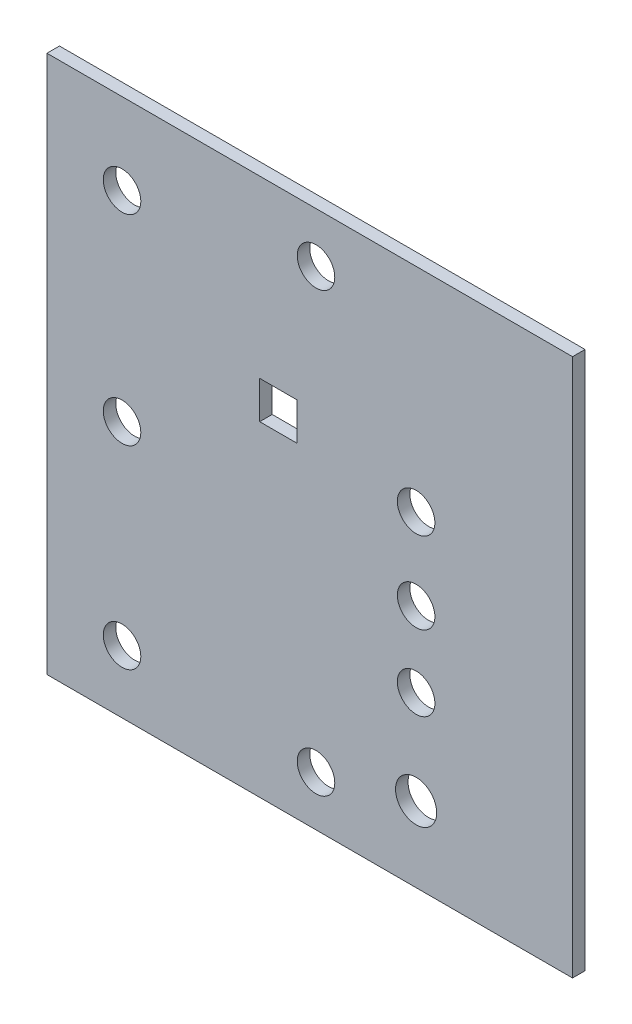
from build123d import *

# Parameters (mm, degrees)
SKETCH_1_W           = 86
SKETCH_1_H           = 86
EXTRUDE_1_DEPTH      = 2
SKETCH_2_R           = 3
CUT_EXTRUDE_1_DEPTH  = 3
SKETCH_3_R           = 3
CUT_EXTRUDE_2_DEPTH  = 3
SKETCH_4_R           = 3
CUT_EXTRUDE_3_DEPTH  = 3
SKETCH_6_R           = 3
CUT_EXTRUDE_4_DEPTH  = 3
SKETCH_7_R           = 3
CUT_EXTRUDE_5_DEPTH  = 3
SKETCH_8_R           = 3
CUT_EXTRUDE_6_DEPTH  = 3
SKETCH_9_R           = 3
CUT_EXTRUDE_7_DEPTH  = 3
SKETCH_10_R          = 3
CUT_EXTRUDE_8_DEPTH  = 3
SKETCH_11_R          = 3.290793372
CUT_EXTRUDE_9_DEPTH  = 3
SKETCH_12_W          = 6
SKETCH_12_H          = 6
CUT_EXTRUDE_10_DEPTH = 3
SKETCH_13_W          = 1
SKETCH_13_H          = 86
CUT_EXTRUDE_11_DEPTH = 3


with BuildPart() as part:
    # 草圖1 → 填料-伸長1 (new body)
    with BuildSketch(Plane.XY):
        with Locations((43, -43)):
            Rectangle(SKETCH_1_W, SKETCH_1_H)
    extrude(amount=EXTRUDE_1_DEPTH)

    # 草圖2 → 除料-伸長1 (cut)
    with BuildSketch(Plane.XY.offset(2)):
        with Locations((13, -13)):
            Circle(SKETCH_2_R)
    extrude(amount=-CUT_EXTRUDE_1_DEPTH, mode=Mode.SUBTRACT)

    # 草圖3 → 除料-伸長2 (cut)
    with BuildSketch(Plane.XY.offset(2)):
        with Locations((13, -45)):
            Circle(SKETCH_3_R)
    extrude(amount=-CUT_EXTRUDE_2_DEPTH, mode=Mode.SUBTRACT)

    # 草圖4 → 除料-伸長3 (cut)
    with BuildSketch(Plane.XY.offset(2)):
        with Locations((13, -76)):
            Circle(SKETCH_4_R)
    extrude(amount=-CUT_EXTRUDE_3_DEPTH, mode=Mode.SUBTRACT)

    # 草圖6 → 除料-伸長4 (cut)
    with BuildSketch(Plane.XY.offset(2)):
        with Locations((44, -8)):
            Circle(SKETCH_6_R)
    extrude(amount=-CUT_EXTRUDE_4_DEPTH, mode=Mode.SUBTRACT)

    # 草圖7 → 除料-伸長5 (cut)
    with BuildSketch(Plane.XY.offset(2)):
        with Locations((44, -78)):
            Circle(SKETCH_7_R)
    extrude(amount=-CUT_EXTRUDE_5_DEPTH, mode=Mode.SUBTRACT)

    # 草圖8 → 除料-伸長6 (cut)
    with BuildSketch(Plane.XY.offset(2)):
        with Locations((60, -34)):
            Circle(SKETCH_8_R)
    extrude(amount=-CUT_EXTRUDE_6_DEPTH, mode=Mode.SUBTRACT)

    # 草圖9 → 除料-伸長7 (cut)
    with BuildSketch(Plane.XY.offset(2)):
        with Locations((60, -47)):
            Circle(SKETCH_9_R)
    extrude(amount=-CUT_EXTRUDE_7_DEPTH, mode=Mode.SUBTRACT)

    # 草圖10 → 除料-伸長8 (cut)
    with BuildSketch(Plane.XY.offset(2)):
        with Locations((60, -59)):
            Circle(SKETCH_10_R)
    extrude(amount=-CUT_EXTRUDE_8_DEPTH, mode=Mode.SUBTRACT)

    # 草圖11 → 除料-伸長9 (cut)
    with BuildSketch(Plane.XY.offset(2)):
        with Locations((60, -74)):
            Circle(SKETCH_11_R)
    extrude(amount=-CUT_EXTRUDE_9_DEPTH, mode=Mode.SUBTRACT)

    # 草圖12 → 除料-伸長10 (cut)
    with BuildSketch(Plane.XY.offset(2)):
        with Locations((38, -31)):
            Rectangle(SKETCH_12_W, SKETCH_12_H)
    extrude(amount=-CUT_EXTRUDE_10_DEPTH, mode=Mode.SUBTRACT)

    # 草圖13 → 除料-伸長11 (cut)
    with BuildSketch(Plane.XY.offset(2)):
        with Locations((85.5, -43)):
            Rectangle(SKETCH_13_W, SKETCH_13_H)
        with Locations((0.5, -43)):
            Rectangle(SKETCH_13_W, SKETCH_13_H)
    extrude(amount=-CUT_EXTRUDE_11_DEPTH, mode=Mode.SUBTRACT)


solid = part.part
